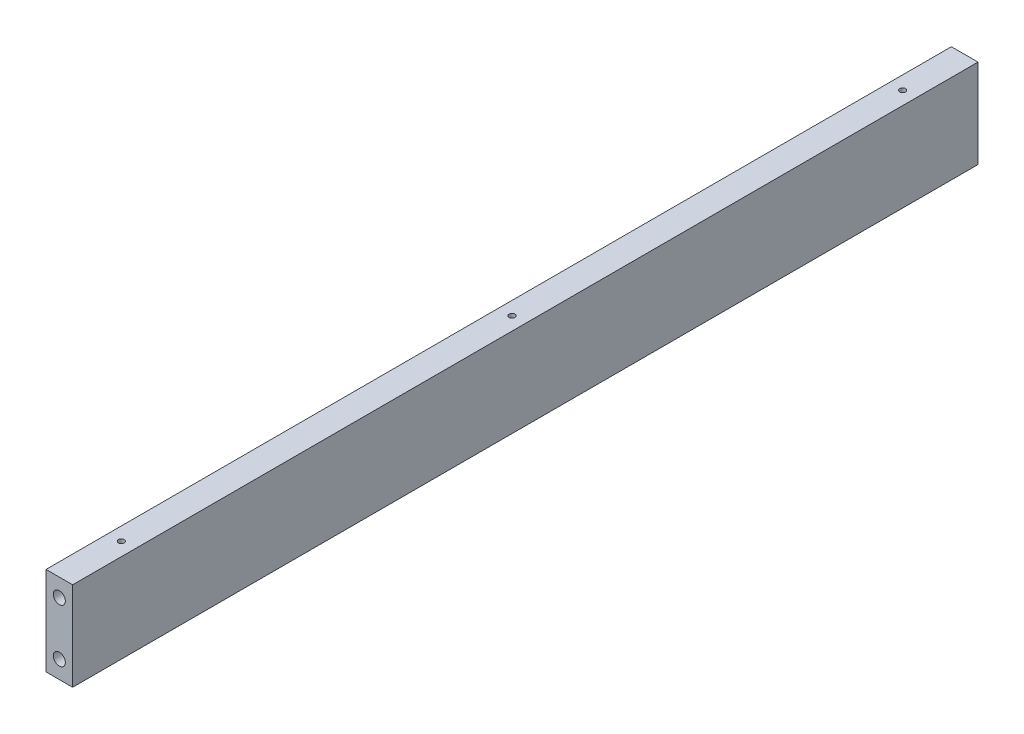
from build123d import *

# Parameters (mm, degrees)
SCHIZZO1_W                     = 15
SCHIZZO1_H                     = 50
ESTRUSIONE1_DEPTH              = 255
FORO_FILETTATO_M8_1_AT_2_COUNT = 2
FORO_FILETTATO_M8_1_AT_2_PITCH = 30
FORO_FILETTATO_M4_1_D          = 3.3
FORO_FILETTATO_M4_1_DEPTH      = 15.5
FORO_FILETTATO_M4_1_TIP        = 0.991420021


with BuildPart() as part:
    # Schizzo1 → Estrusione1 (new, symmetric)
    with BuildSketch(Plane.XY):
        Rectangle(SCHIZZO1_W, SCHIZZO1_H)
    extrude(amount=ESTRUSIONE1_DEPTH, both=True)

    # Schizzo3 → Foro filettato M8-1 (revolve, cut)
    with BuildSketch(Plane(origin=(0, 15, 255), x_dir=(0, -1, 0), z_dir=(1, 0, 0))):
        Polygon((0, 0), (0, 28.292926105), (3.4, 26.25), (3.4, 0), align=None)
    foro_filettato_m8_1 = revolve(axis=Axis((0, 15, 261.35), (0, 0, -1)), mode=Mode.SUBTRACT)

    # Foro filettato M8-1 at 2: Foro filettato M8-1 ×2
    with Locations(*[(0, -i * FORO_FILETTATO_M8_1_AT_2_PITCH, 0) for i in range(1, FORO_FILETTATO_M8_1_AT_2_COUNT)]):
        add(foro_filettato_m8_1, mode=Mode.SUBTRACT)

    # Specchia1: Foro filettato M8-1 across plane
    add(foro_filettato_m8_1.mirror(Plane.XY), mode=Mode.SUBTRACT)

    # Specchia1 copy 1 sketch → Specchia1 copy 1 (revolve, cut)
    with BuildSketch(Plane(origin=(0, -15, -255), x_dir=(0, -1, 0), z_dir=(1, 0, 0))):
        Polygon((0, 0), (0, -28.292926105), (3.4, -26.25), (3.4, 0), align=None)
    revolve(axis=Axis((0, -15, -261.35), (0, 0, -1)), mode=Mode.SUBTRACT)

    # Foro filettato M4-1
    with Locations(Plane(origin=(0, 25, 0), x_dir=(1, 0, 0), z_dir=(0, 1, 0))):
        with Locations((0, 0), (0, 220), (0, -220)):
            Hole(FORO_FILETTATO_M4_1_D / 2, depth=FORO_FILETTATO_M4_1_DEPTH)
            with Locations((0, 0, -(FORO_FILETTATO_M4_1_DEPTH + FORO_FILETTATO_M4_1_TIP / 2))):  # 118° drill point
                Cone(0, FORO_FILETTATO_M4_1_D / 2, FORO_FILETTATO_M4_1_TIP, mode=Mode.SUBTRACT)


solid = part.part
